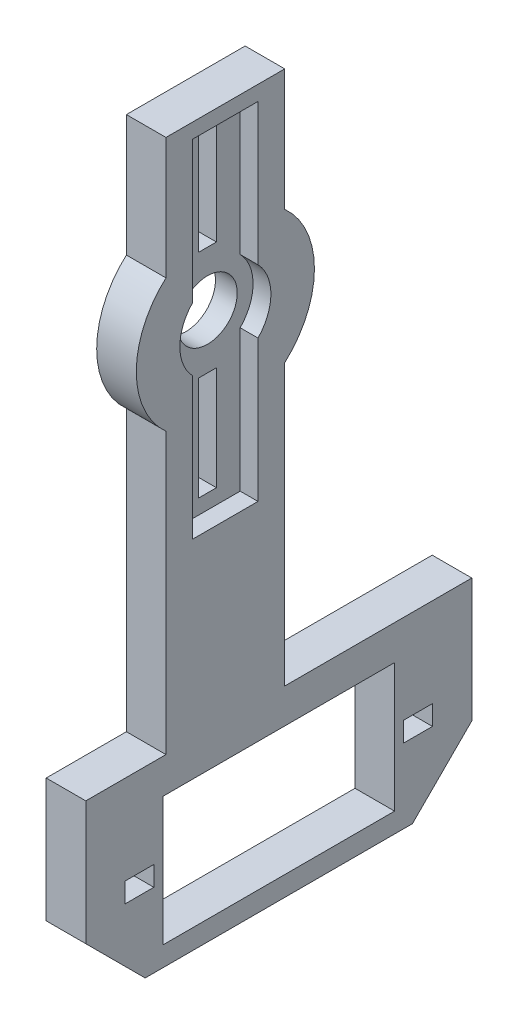
from build123d import *

# Parameters (mm, degrees)
BOSS_EXTRUDE1_START  = -70.4
SKETCH1_R            = 9
BOSS_EXTRUDE1_DEPTH  = 4
BOSS_EXTRUDE2_START  = 60
SKETCH2_W            = 4
SKETCH2_H            = 55
BOSS_EXTRUDE2_DEPTH  = 12
BOSS_EXTRUDE3_START  = 41.1
SKETCH3_W            = 4
SKETCH3_H            = 18.5
BOSS_EXTRUDE3_DEPTH  = 39
BOSS_EXTRUDE4_START  = -71.4
BOSS_EXTRUDE4_DEPTH  = 6
BOSS_EXTRUDE5_START  = -71.4
BOSS_EXTRUDE5_DEPTH  = 6
BOSS_EXTRUDE6_START  = -68.2
SKETCH6_R            = 4.6
BOSS_EXTRUDE6_DEPTH  = 2.3
BOSS_EXTRUDE7_START  = 62.7
SKETCH7_W            = 2.3
SKETCH7_H            = 17.5
BOSS_EXTRUDE7_DEPTH  = 6.6
BOSS_EXTRUDE8_START  = 65.1
SKETCH8_W            = 6
SKETCH8_H            = 10.5
BOSS_EXTRUDE8_DEPTH  = 1.8
BOSS_EXTRUDE9_START  = 62.7
SKETCH9_W            = 2.3
SKETCH9_H            = 17.5
BOSS_EXTRUDE9_DEPTH  = 6.6
BOSS_EXTRUDE10_START = 65.1
SKETCH10_W           = 6
SKETCH10_H           = 10.5
BOSS_EXTRUDE10_DEPTH = 1.8
BOSS_EXTRUDE11_START = -71.4
SKETCH11_R           = 3
BOSS_EXTRUDE11_DEPTH = 6
BOSS_EXTRUDE12_START = 48.9
SKETCH12_W           = 6
SKETCH12_H           = 13
BOSS_EXTRUDE12_DEPTH = 23.4
BOSS_EXTRUDE13_START = 45.075
SKETCH13_W           = 6
SKETCH13_H           = 2
BOSS_EXTRUDE13_DEPTH = 2.9
BOSS_EXTRUDE14_START = 73.225
SKETCH14_W           = 6
SKETCH14_H           = 2
BOSS_EXTRUDE14_DEPTH = 2.9


with BuildPart() as part:
    # Sketch1 → Boss-Extrude1 (new body)
    with BuildSketch(Plane(origin=(0, 0, 0), x_dir=(0, 0, -1), z_dir=(1, 0, 0)).offset(BOSS_EXTRUDE1_START)):
        with Locations((-66, -20)):
            Circle(SKETCH1_R)
    extrude(amount=BOSS_EXTRUDE1_DEPTH)

    # Sketch2 → Boss-Extrude2 (add)
    with BuildSketch(Plane.XY.offset(BOSS_EXTRUDE2_START)):
        with Locations((-68.4, -28.5)):
            Rectangle(SKETCH2_W, SKETCH2_H)
    extrude(amount=BOSS_EXTRUDE2_DEPTH)

    # Sketch3 → Boss-Extrude3 (add)
    with BuildSketch(Plane.XY.offset(BOSS_EXTRUDE3_START)):
        with Locations((-68.4, -64.25)):
            Rectangle(SKETCH3_W, SKETCH3_H)
    extrude(amount=BOSS_EXTRUDE3_DEPTH)


with BuildPart() as body_2:
    # Sketch4 → Boss-Extrude4 (new body)
    with BuildSketch(Plane(origin=(0, 0, 0), x_dir=(0, 0, -1), z_dir=(1, 0, 0)).offset(BOSS_EXTRUDE4_START)):
        Polygon((-81.1, -74.5), (-73.1, -74.5), (-81.1, -66.5), align=None)
    extrude(amount=BOSS_EXTRUDE4_DEPTH)


with BuildPart() as part_1:
    add(part.part)

    # Combine1: cut body 2
    add(body_2.part, mode=Mode.SUBTRACT)


with BuildPart() as body_2_2:
    # Sketch5 → Boss-Extrude5 (new body)
    with BuildSketch(Plane(origin=(0, 0, 0), x_dir=(0, 0, -1), z_dir=(1, 0, 0)).offset(BOSS_EXTRUDE5_START)):
        Polygon((-40.1, -74.5), (-48.1, -74.5), (-40.1, -66.5), align=None)
    extrude(amount=BOSS_EXTRUDE5_DEPTH)


with BuildPart() as part_2:
    add(part_1.part)

    # Combine2: cut body 2 2
    add(body_2_2.part, mode=Mode.SUBTRACT)


with BuildPart() as body_2_3:
    # Sketch6 → Boss-Extrude6 (new body)
    with BuildSketch(Plane(origin=(0, 0, 0), x_dir=(0, 0, -1), z_dir=(1, 0, 0)).offset(BOSS_EXTRUDE6_START)):
        with Locations((-66, -20)):
            Circle(SKETCH6_R)
    extrude(amount=BOSS_EXTRUDE6_DEPTH)


with BuildPart() as part_3:
    add(part_2.part)

    # Combine3: cut body 2 3
    add(body_2_3.part, mode=Mode.SUBTRACT)


with BuildPart() as body_2_4:
    # Sketch7 → Boss-Extrude7 (new body)
    with BuildSketch(Plane.XY.offset(BOSS_EXTRUDE7_START)):
        with Locations((-67.05, -11.25)):
            Rectangle(SKETCH7_W, SKETCH7_H)
    extrude(amount=BOSS_EXTRUDE7_DEPTH)


with BuildPart() as part_4:
    add(part_3.part)

    # Combine4: cut body 2 4
    add(body_2_4.part, mode=Mode.SUBTRACT)


with BuildPart() as body_2_5:
    # Sketch8 → Boss-Extrude8 (new body)
    with BuildSketch(Plane.XY.offset(BOSS_EXTRUDE8_START)):
        with Locations((-68.4, -9.25)):
            Rectangle(SKETCH8_W, SKETCH8_H)
    extrude(amount=BOSS_EXTRUDE8_DEPTH)


with BuildPart() as part_5:
    add(part_4.part)

    # Combine5: cut body 2 5
    add(body_2_5.part, mode=Mode.SUBTRACT)


with BuildPart() as body_2_6:
    # Sketch9 → Boss-Extrude9 (new body)
    with BuildSketch(Plane.XY.offset(BOSS_EXTRUDE9_START)):
        with Locations((-67.05, -28.75)):
            Rectangle(SKETCH9_W, SKETCH9_H)
    extrude(amount=BOSS_EXTRUDE9_DEPTH)


with BuildPart() as part_6:
    add(part_5.part)

    # Combine6: cut body 2 6
    add(body_2_6.part, mode=Mode.SUBTRACT)


with BuildPart() as body_2_7:
    # Sketch10 → Boss-Extrude10 (new body)
    with BuildSketch(Plane.XY.offset(BOSS_EXTRUDE10_START)):
        with Locations((-68.4, -30.75)):
            Rectangle(SKETCH10_W, SKETCH10_H)
    extrude(amount=BOSS_EXTRUDE10_DEPTH)


with BuildPart() as part_7:
    add(part_6.part)

    # Combine7: cut body 2 7
    add(body_2_7.part, mode=Mode.SUBTRACT)


with BuildPart() as body_2_8:
    # Sketch11 → Boss-Extrude11 (new body)
    with BuildSketch(Plane(origin=(0, 0, 0), x_dir=(0, 0, -1), z_dir=(1, 0, 0)).offset(BOSS_EXTRUDE11_START)):
        with Locations((-66, -20)):
            Circle(SKETCH11_R)
    extrude(amount=BOSS_EXTRUDE11_DEPTH)


with BuildPart() as part_8:
    add(part_7.part)

    # Combine8: cut body 2 8
    add(body_2_8.part, mode=Mode.SUBTRACT)


with BuildPart() as body_2_9:
    # Sketch12 → Boss-Extrude12 (new body)
    with BuildSketch(Plane.XY.offset(BOSS_EXTRUDE12_START)):
        with Locations((-68.4, -65)):
            Rectangle(SKETCH12_W, SKETCH12_H)
    extrude(amount=BOSS_EXTRUDE12_DEPTH)


with BuildPart() as part_9:
    add(part_8.part)

    # Combine9: cut body 2 9
    add(body_2_9.part, mode=Mode.SUBTRACT)


with BuildPart() as body_2_10:
    # Sketch13 → Boss-Extrude13 (new body)
    with BuildSketch(Plane.XY.offset(BOSS_EXTRUDE13_START)):
        with Locations((-68.4, -65)):
            Rectangle(SKETCH13_W, SKETCH13_H)
    extrude(amount=BOSS_EXTRUDE13_DEPTH)


with BuildPart() as part_10:
    add(part_9.part)

    # Combine10: cut body 2 10
    add(body_2_10.part, mode=Mode.SUBTRACT)


with BuildPart() as body_2_11:
    # Sketch14 → Boss-Extrude14 (new body)
    with BuildSketch(Plane.XY.offset(BOSS_EXTRUDE14_START)):
        with Locations((-68.4, -65)):
            Rectangle(SKETCH14_W, SKETCH14_H)
    extrude(amount=BOSS_EXTRUDE14_DEPTH)


with BuildPart() as part_11:
    add(part_10.part)

    # Combine11: cut body 2 11
    add(body_2_11.part, mode=Mode.SUBTRACT)


solid = part_11.part
